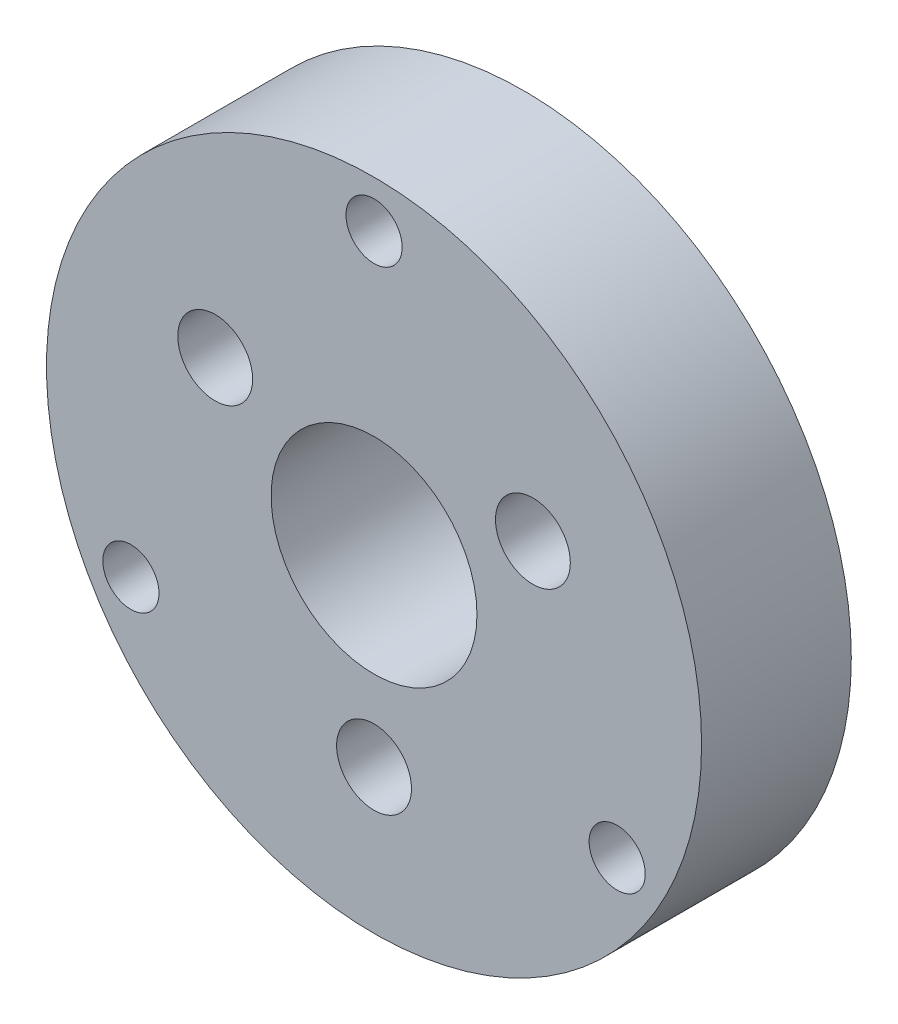
from build123d import *

# Parameters (mm, degrees)
SKETCH_1_R          = 17.5
SKETCH_1_R_2        = 1.5
SKETCH_1_R_3        = 5.5
EXTRUDE_1_DEPTH     = 8
SKETCH_2_R          = 2
CUT_EXTRUDE_1_DEPTH = 19


with BuildPart() as part:
    # 草图1 → 凸台-拉伸1 (new body)
    with BuildSketch(Plane.XY):
        Circle(SKETCH_1_R)
        with Locations((0, 15)):
            Circle(SKETCH_1_R_2, mode=Mode.SUBTRACT)
        with Locations((12.990381057, -7.5)):
            Circle(SKETCH_1_R_2, mode=Mode.SUBTRACT)
        with Locations((-12.990381057, -7.5)):
            Circle(SKETCH_1_R_2, mode=Mode.SUBTRACT)
        Circle(SKETCH_1_R_3, mode=Mode.SUBTRACT)
    extrude(amount=EXTRUDE_1_DEPTH)

    # 草图2 → 切除-拉伸1 (cut)
    with BuildSketch(Plane.XY):
        with Locations((-8.487048957, 4.9)):
            Circle(SKETCH_2_R)
        with Locations((8.487048957, 4.9)):
            Circle(SKETCH_2_R)
        with Locations((0, -9.8)):
            Circle(SKETCH_2_R)
    extrude(amount=CUT_EXTRUDE_1_DEPTH, mode=Mode.SUBTRACT)


solid = part.part
